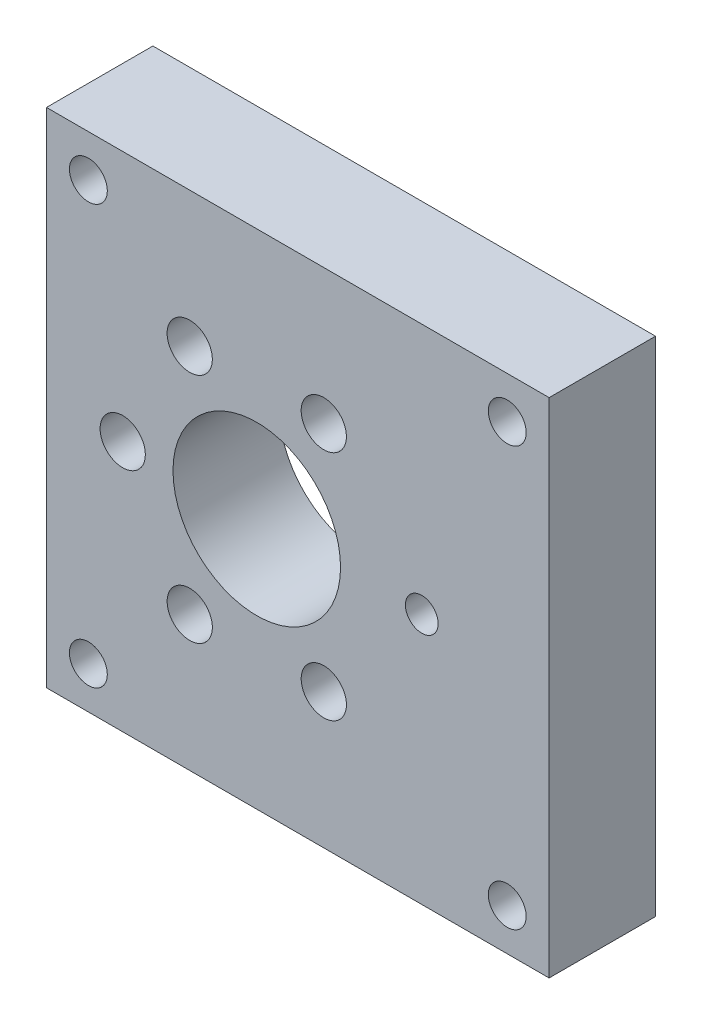
from build123d import *

# Parameters (mm, degrees)
SKETCH1_W              = 30
SKETCH1_H              = 30
BOSS_EXTRUDE1_DEPTH    = 6.35
F_2_CLEARANCE_HOLE1_D  = 2.2606
SKETCH4_R              = 4.99999
CUT_EXTRUDE1_DEPTH     = 43.898980174
M2_5_CLEARANCE_HOLE1_D = 2.7
SKETCH9_R              = 0.9779
CUT_EXTRUDE2_DEPTH     = 43.898980174


with BuildPart() as part:
    # Sketch1 → Boss-Extrude1 (new body)
    with BuildSketch(Plane.XY):
        with Locations((15, 15)):
            Rectangle(SKETCH1_W, SKETCH1_H)
    extrude(amount=BOSS_EXTRUDE1_DEPTH)

    # #2 Clearance Hole1 (through all)
    with Locations(Plane.XY.offset(6.35)):
        with Locations((2.5, 27.5), (27.5, 27.5), (2.5, 2.5), (27.5, 2.5)):
            Hole(F_2_CLEARANCE_HOLE1_D / 2)

    # Sketch4 → Cut-Extrude1 (cut, through all)
    with BuildSketch(Plane.XY.offset(6.35)):
        with Locations((12.55014, 15.00124)):
            Circle(SKETCH4_R)
    extrude(amount=-CUT_EXTRUDE1_DEPTH, mode=Mode.SUBTRACT)

    # M2.5 Clearance Hole1 (through all)
    with Locations(Plane.XY.offset(6.35)):
        with Locations((16.551324598, 8.072566042), (8.550324637, 8.071775514), (4.549140039, 15.000449472), (8.548955402, 21.929913958), (16.549955363, 21.930704486)):
            Hole(M2_5_CLEARANCE_HOLE1_D / 2)

    # Sketch9 → Cut-Extrude2 (cut, through all)
    with BuildSketch(Plane.XY.offset(6.35)):
        with Locations((22.40032, 15)):
            Circle(SKETCH9_R)
    extrude(amount=-CUT_EXTRUDE2_DEPTH, mode=Mode.SUBTRACT)


solid = part.part
